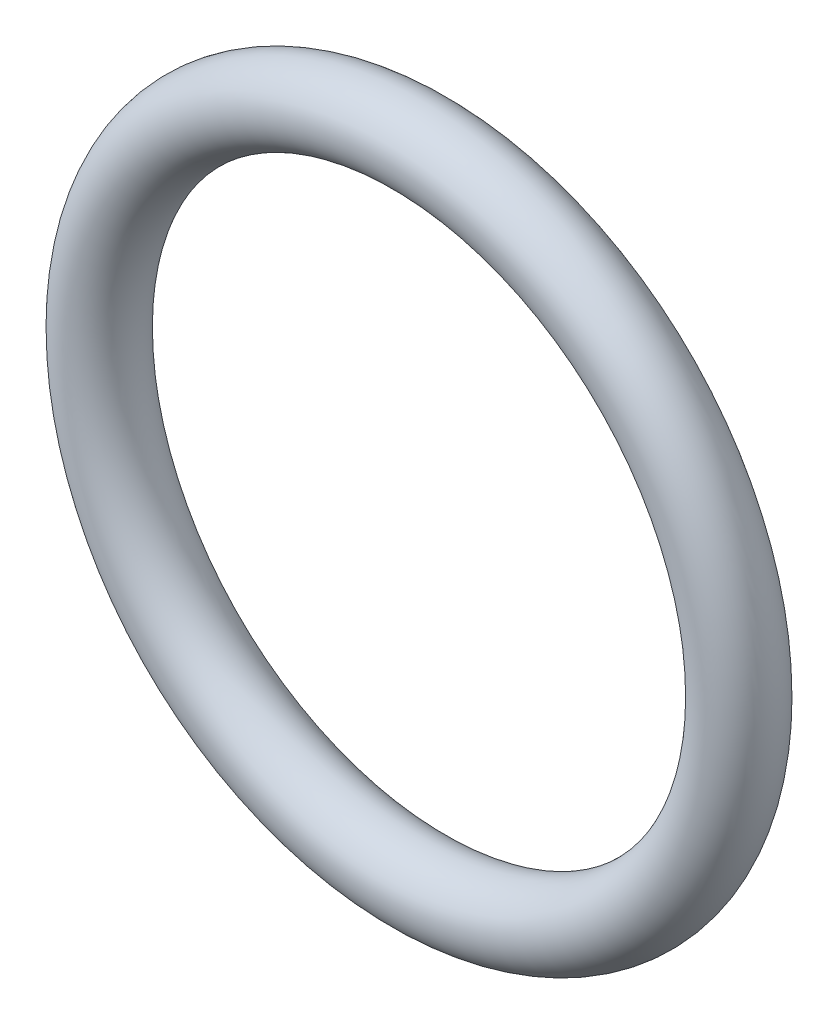
from build123d import *

# Parameters (mm, degrees)
SWEEP1_PROFILE_R = 2.5


with BuildPart() as part:
    # Sweep1: sweep along a path in Sketch1
    with BuildLine(Plane.XY) as sweep1_path:
        CenterArc((0, 0), 21.25, 0, 360)
    # Sweep1 profile (on start of the path) → Sweep1 (sweep)
    with BuildSketch(Plane(origin=(21.25, 0, 0), x_dir=(0, 0, 1), z_dir=(0, 1, 0))):
        Circle(SWEEP1_PROFILE_R)
    sweep(path=sweep1_path.line)


solid = part.part
